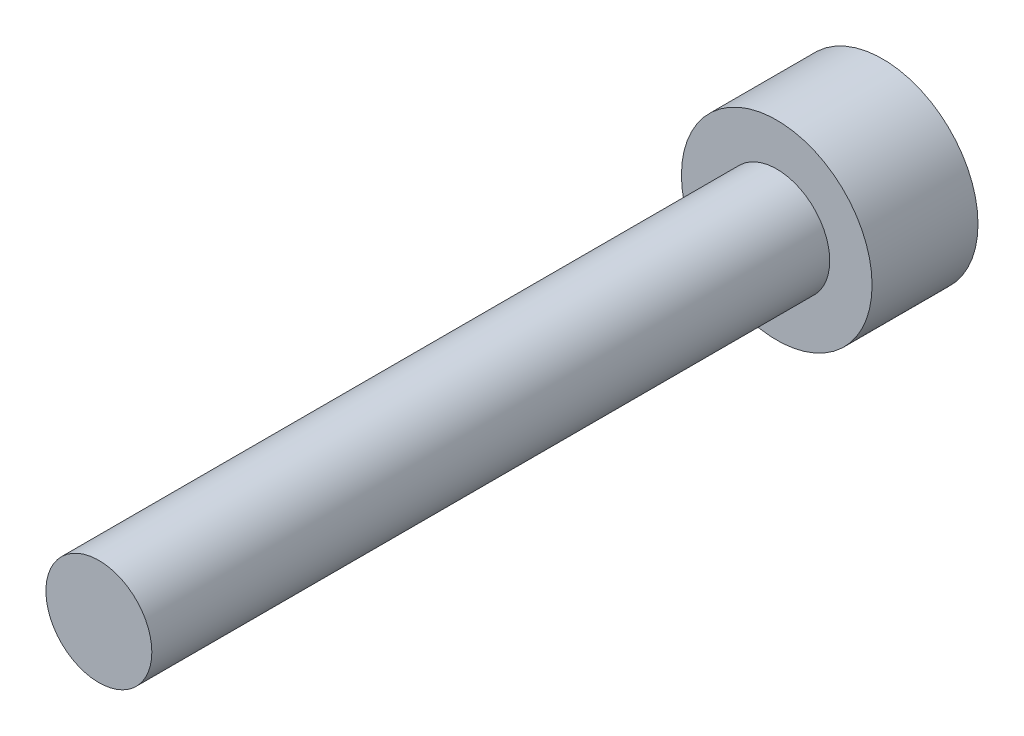
from build123d import *

# Parameters (mm, degrees)
CABEZA_START            = -2.5
SK_CABEZA_R             = 2.25
CABEZA_DEPTH            = 2.5
SK_CUERPO_R             = 1.25
CUERPO_DEPTH            = 16
HEXAGONO_INTERIOR_START = -2.5
HEXAGONO_INTERIOR_DEPTH = 1.25


with BuildPart() as part:
    # Sk_Cabeza → Cabeza (new body)
    with BuildSketch(Plane.XY.offset(CABEZA_START)):
        Circle(SK_CABEZA_R)
    extrude(amount=CABEZA_DEPTH)

    # Sk_Cuerpo → Cuerpo (add)
    with BuildSketch(Plane.XY):
        Circle(SK_CUERPO_R)
    extrude(amount=CUERPO_DEPTH)

    # Sk_Hexagono_interior → Hexagono_interior (cut)
    with BuildSketch(Plane.XY.offset(HEXAGONO_INTERIOR_START)):
        Polygon((0, -1.154700538), (1, -0.577350269), (1, 0.577350269), (0, 1.154700538), (-1, 0.577350269), (-1, -0.577350269), align=None)
    extrude(amount=HEXAGONO_INTERIOR_DEPTH, mode=Mode.SUBTRACT)


solid = part.part
